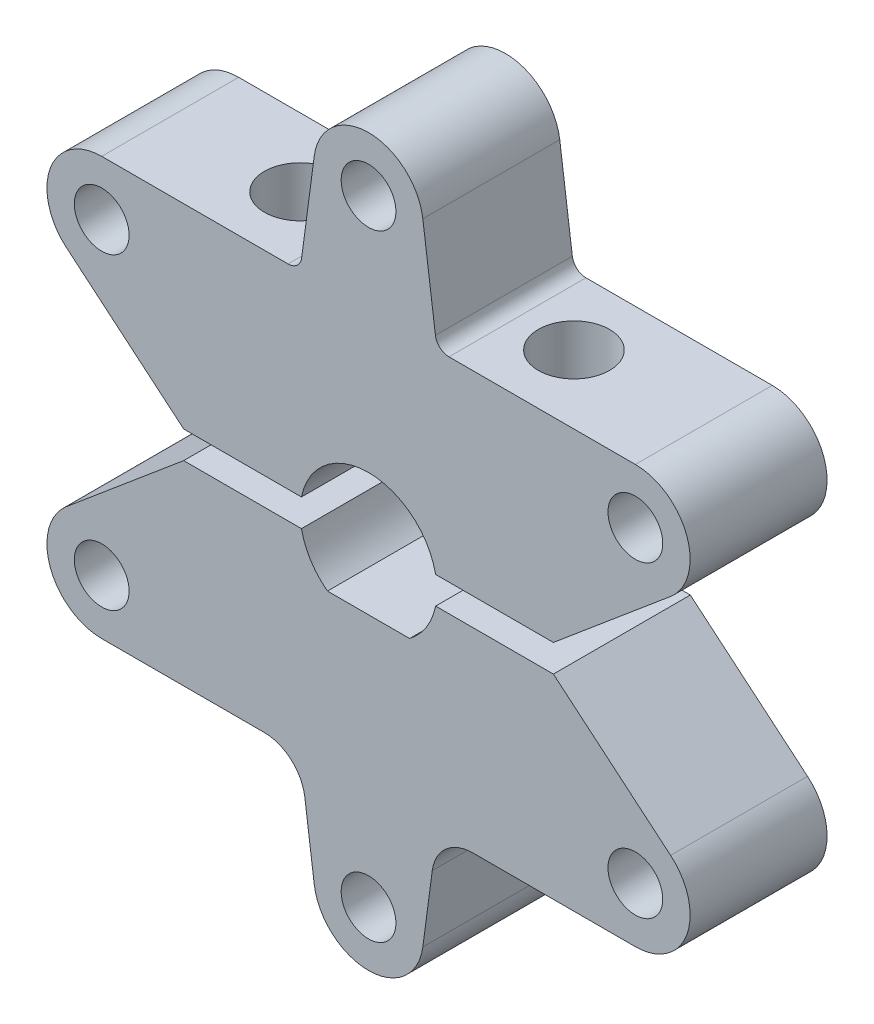
from build123d import *

# Parameters (mm, degrees)
SKETCH_1_R               = 2
EXTRUDE_1_DEPTH          = 10
EXTRUDE_1_2_DEPTH        = 10
CUT_EXTRUDE_2_DEPTH      = 40.772126831
CUT_EXTRUDE_2_DEPTH_BACK = 14.25
SKETCH_3_R               = 2.6
SKETCH_4_R               = 2
CUT_EXTRUDE_3_DEPTH      = 40.772126831
SKETCH_5_R               = 2
EXTRUDE_2_DEPTH          = 10
FILLET_1_R               = 3
FILLET_2_R               = 1
SCALE_1_SCALE            = 0.8
SCALE_2_SCALE            = 0.8
SCALE_3_SCALE            = 0.8


with BuildPart() as part:
    # 草图1 → 凸台-拉伸1 (new body)
    with BuildSketch(Plane.XY):
        with BuildLine():
            Line((-3, -4), (3, -4))
            ThreePointArc((3, -4), (4.224744871, -2.674234614), (4.898979486, -1))
            Line((4.898979486, -1), (13.5, -1))
            Line((13.5, -1), (22.057956933, -8.186858864))
            ThreePointArc((22.057956933, -8.186858864), (23.244066267, -12.618838094), (19.485571585, -15.25))
            Line((19.485571585, -15.25), (-19.485571585, -15.25))
            ThreePointArc((-19.485571585, -15.25), (-23.244066267, -12.618838094), (-22.057956933, -8.186858864))
            Line((-22.057956933, -8.186858864), (-13.5, -1))
            Line((-13.5, -1), (-4.898979486, -1))
            ThreePointArc((-4.898979486, -1), (-4.224744871, -2.674234614), (-3, -4))
        make_face()
        with Locations((19.485571585, -11.25)):
            Circle(SKETCH_1_R, mode=Mode.SUBTRACT)
        with Locations((-19.485571585, -11.25)):
            Circle(SKETCH_1_R, mode=Mode.SUBTRACT)
    extrude(amount=EXTRUDE_1_DEPTH)

    # 草图4 → 切除-拉伸3 (cut, through all)
    with BuildSketch(Plane(origin=(0, 15.25, 0), x_dir=(1, 0, 0), z_dir=(0, 1, 0))):
        with Locations(Location((10, -5, 0), (0, 0, 180))):
            Circle(SKETCH_4_R)
        with Locations(Location((-10, -5, 0), (0, 0, 180))):
            Circle(SKETCH_4_R)
    extrude(amount=-CUT_EXTRUDE_3_DEPTH, mode=Mode.SUBTRACT)



with BuildPart() as body_2:
    # 草图1 → Extrude 1 2 (new body)
    with BuildSketch(Plane.XY):
        with BuildLine():
            Line((-13.5, 1), (-4.898979486, 1))
            ThreePointArc((-4.898979486, 1), (0, 5), (4.898979486, 1))
            Line((4.898979486, 1), (13.5, 1))
            Line((13.5, 1), (22.057956933, 8.186858864))
            ThreePointArc((22.057956933, 8.186858864), (23.244066267, 12.618838094), (19.485571585, 15.25))
            Line((19.485571585, 15.25), (-19.485571585, 15.25))
            ThreePointArc((-19.485571585, 15.25), (-23.244066267, 12.618838094), (-22.057956933, 8.186858864))
            Line((-22.057956933, 8.186858864), (-13.5, 1))
        make_face()
        with Locations((19.485571585, 11.25)):
            Circle(SKETCH_1_R, mode=Mode.SUBTRACT)
        with Locations((-19.485571585, 11.25)):
            Circle(SKETCH_1_R, mode=Mode.SUBTRACT)
    extrude(amount=EXTRUDE_1_2_DEPTH)

    # 草图3 → 切除-拉伸2 (cut, two sides: drawn at the far end of the back side and taken through both)
    with BuildSketch(Plane(origin=(0, 15.25, 0), x_dir=(1, 0, 0), z_dir=(0, 1, 0)).offset(-CUT_EXTRUDE_2_DEPTH_BACK)):
        with Locations((10, -5)):
            Circle(SKETCH_3_R)
        with Locations((-10, -5)):
            Circle(SKETCH_3_R)
    extrude(amount=CUT_EXTRUDE_2_DEPTH + CUT_EXTRUDE_2_DEPTH_BACK, mode=Mode.SUBTRACT)


with BuildPart() as part_1:
    add(part.part)

    add(body_2.part)  # 凸台-拉伸2 merges body 2
    # 草图5 → 凸台-拉伸2 (add)
    # profile 1 of 2: a face of its own
    with BuildSketch(Plane(origin=(0, 0, 0), x_dir=(-1, 0, 0), z_dir=(0, 0, -1))):
        with BuildLine():
            Line((-3.965049412, -23.027620284), (-5, -15.25))
            Line((-5, -15.25), (5, -15.25))
            Line((5, -15.25), (3.965049412, -23.027620284))
            ThreePointArc((3.965049412, -23.027620284), (0, -26.5), (-3.965049412, -23.027620284))
        make_face()
        with Locations((0, -22.5)):
            Circle(SKETCH_5_R, mode=Mode.SUBTRACT)
    # profile 2 of 2: a face of its own
    with BuildSketch(Plane(origin=(0, 0, 0), x_dir=(-1, 0, 0), z_dir=(0, 0, -1))):
        with BuildLine():
            Line((5, 15.25), (3.965049412, 23.027620284))
            ThreePointArc((3.965049412, 23.027620284), (0, 26.5), (-3.965049412, 23.027620284))
            Line((-3.965049412, 23.027620284), (-5, 15.25))
            Line((-5, 15.25), (5, 15.25))
        make_face()
        with Locations((0, 22.5)):
            Circle(SKETCH_5_R, mode=Mode.SUBTRACT)
    extrude(amount=-EXTRUDE_2_DEPTH)

    # 圆角1
    fillet_1_edges = [part_1.edges().sort_by_distance(p)[0] for p in [
        (-5, -15.25, 5),
        (5, -15.25, 5),
    ]]
    fillet(fillet_1_edges, radius=FILLET_1_R)

    # 圆角2
    fillet_2_edges = [part_1.edges().sort_by_distance(p)[0] for p in [
        (5, 15.25, 5),
        (-5, 15.25, 5),
    ]]
    fillet(fillet_2_edges, radius=FILLET_2_R)


with BuildPart() as part_2:
    # 缩放比例1: scaled about (0, 0, 0)
    add(part_1.part.scale(SCALE_1_SCALE))


with BuildPart() as part_3:
    # 缩放比例2: scaled about (0, 0, 0)
    add(part_2.part.scale(SCALE_2_SCALE))


with BuildPart() as part_4:
    # 缩放比例3: scaled about (0, 0, 0)
    add(part_3.part.scale(SCALE_3_SCALE))


solid = part_4.part
